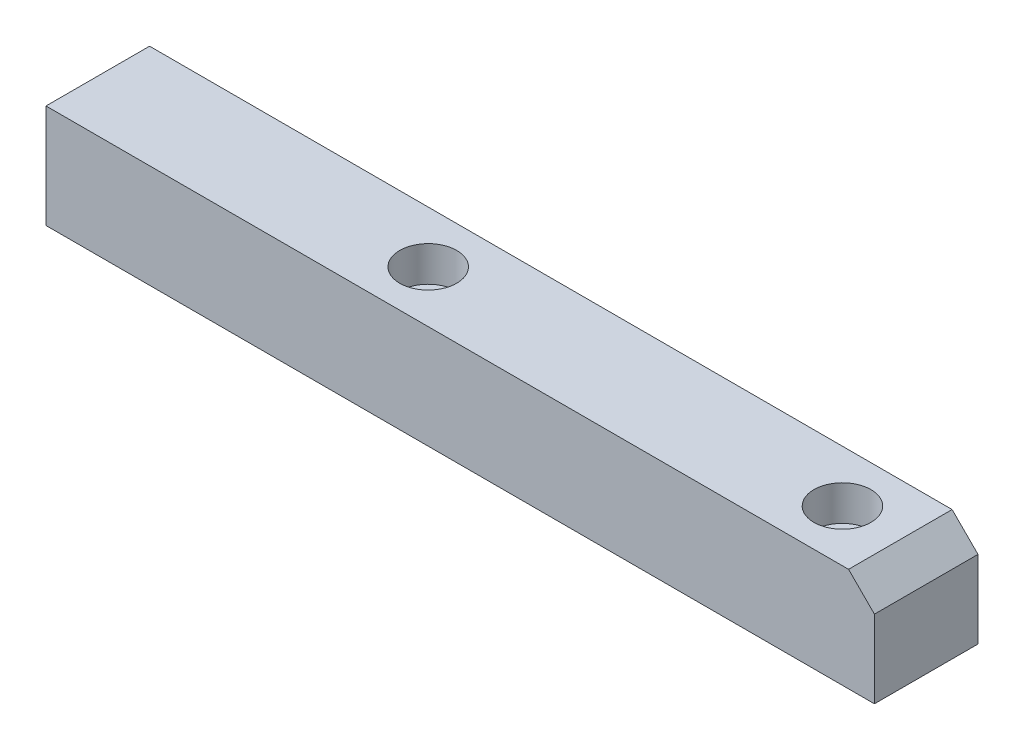
from build123d import *

# Parameters (mm, degrees)
SKETCH1_W                                            = 160
SKETCH1_H                                            = 20
BOSS_EXTRUDE1_DEPTH                                  = 10
CBORE_FOR_M6_SLOTTED_CHEESE_HEAD_SCREWS2_D           = 6.6
CBORE_FOR_M6_SLOTTED_CHEESE_HEAD_SCREWS2_CBORE_D     = 11
CBORE_FOR_M6_SLOTTED_CHEESE_HEAD_SCREWS2_CBORE_DEPTH = 6.8
M6_TAPPED_HOLE1_D                                    = 5
M6_TAPPED_HOLE1_DEPTH                                = 15
M6_TAPPED_HOLE1_TIP                                  = 1.502151548
CHAMFER1_SIZE                                        = 5


with BuildPart() as part:
    # Sketch1 → Boss-Extrude1 (new, symmetric)
    with BuildSketch(Plane(origin=(0, 0, 0), x_dir=(1, 0, 0), z_dir=(0, 1, 0))):
        Rectangle(SKETCH1_W, SKETCH1_H)
    extrude(amount=BOSS_EXTRUDE1_DEPTH, both=True)

    # CBORE for M6 Slotted cheese head screws2 (through all)
    with Locations(Plane(origin=(0, 10, 0), x_dir=(1, 0, 0), z_dir=(0, 1, 0))):
        with Locations((-16.182, 0), (63.818, 0)):
            CounterBoreHole(CBORE_FOR_M6_SLOTTED_CHEESE_HEAD_SCREWS2_D / 2, CBORE_FOR_M6_SLOTTED_CHEESE_HEAD_SCREWS2_CBORE_D / 2, CBORE_FOR_M6_SLOTTED_CHEESE_HEAD_SCREWS2_CBORE_DEPTH)

    # M6 Tapped Hole1
    with Locations(Plane.ZY.offset(80)):
        with Locations((0, 0)):
            Hole(M6_TAPPED_HOLE1_D / 2, depth=M6_TAPPED_HOLE1_DEPTH)
            with Locations((0, 0, -(M6_TAPPED_HOLE1_DEPTH + M6_TAPPED_HOLE1_TIP / 2))):  # 118° drill point
                Cone(0, M6_TAPPED_HOLE1_D / 2, M6_TAPPED_HOLE1_TIP, mode=Mode.SUBTRACT)

    # Chamfer1
    chamfer1_edges = [part.edges().sort_by_distance(p)[0] for p in [
        (80, 10, 0),
    ]]
    chamfer(chamfer1_edges, length=CHAMFER1_SIZE)


solid = part.part
